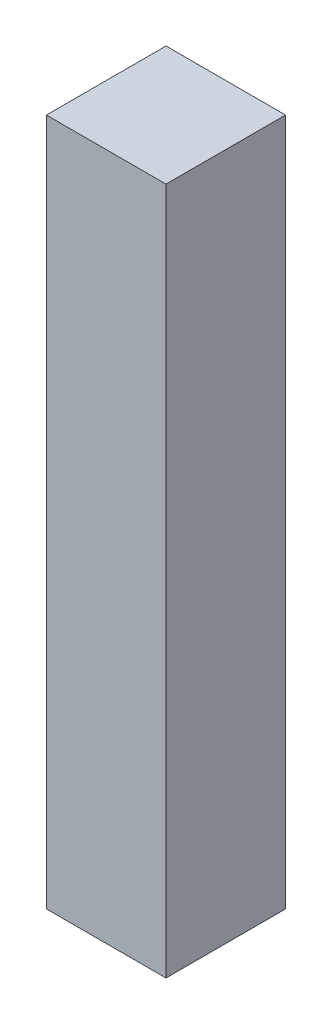
from build123d import *

# Parameters (mm, degrees)
SKETCH_1_W      = 40
SKETCH_1_H      = 40
EXTRUDE_1_DEPTH = 230


with BuildPart() as part:
    # Эскиз1 → Бобышка-Вытянуть1 (new body)
    with BuildSketch(Plane(origin=(0, 0, 0), x_dir=(1, 0, 0), z_dir=(0, 1, 0))):
        with Locations((-467.247374962, -667.030369645)):
            Rectangle(SKETCH_1_W, SKETCH_1_H)
    extrude(amount=EXTRUDE_1_DEPTH)


solid = part.part
